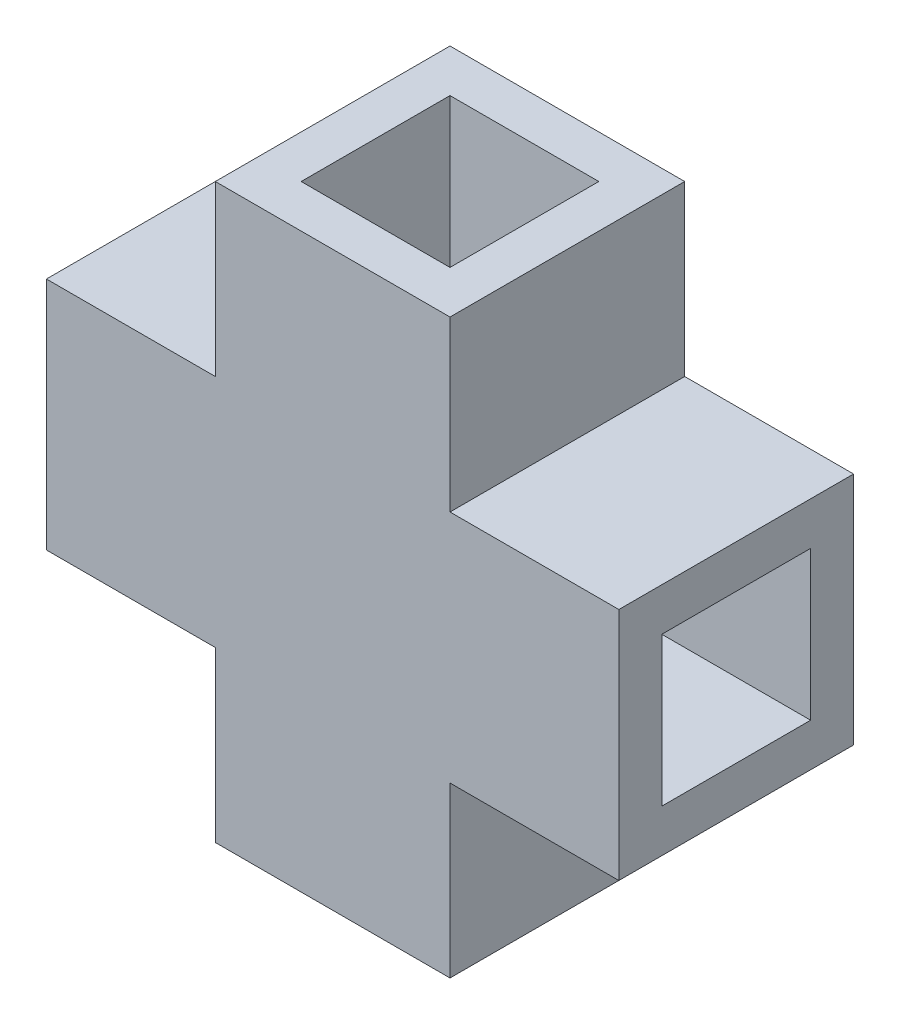
from build123d import *

# Parameters (mm, degrees)
SKETCH1_W           = 5.9
SKETCH1_H           = 8.2
SKETCH1_W_2         = 8.2
SKETCH1_H_2         = 5.9
BOSS_EXTRUDE1_DEPTH = 8.2
SHELL1_T            = -1.5


with BuildPart() as part:
    # Sketch1 → Boss-Extrude1 (new body)
    with BuildSketch(Plane.XY):
        with Locations((-7.05, 0)):
            Rectangle(SKETCH1_W, SKETCH1_H)
        with Locations((0, 7.05)):
            Rectangle(SKETCH1_W_2, SKETCH1_H_2)
        Rectangle(SKETCH1_W_2, SKETCH1_H)
        with Locations((7.05, 0)):
            Rectangle(SKETCH1_W, SKETCH1_H)
        with Locations((0, -7.05)):
            Rectangle(SKETCH1_W_2, SKETCH1_H_2)
    extrude(amount=BOSS_EXTRUDE1_DEPTH)

    # Shell1
    shell1_openings = [part.faces().sort_by_distance(p)[0] for p in [
        (0, 10, 4.1),
        (10, 0, 4.1),
        (0, -10, 4.1),
        (-10, 0, 4.1),
    ]]
    offset(amount=SHELL1_T, openings=shell1_openings, kind=Kind.INTERSECTION)


solid = part.part
